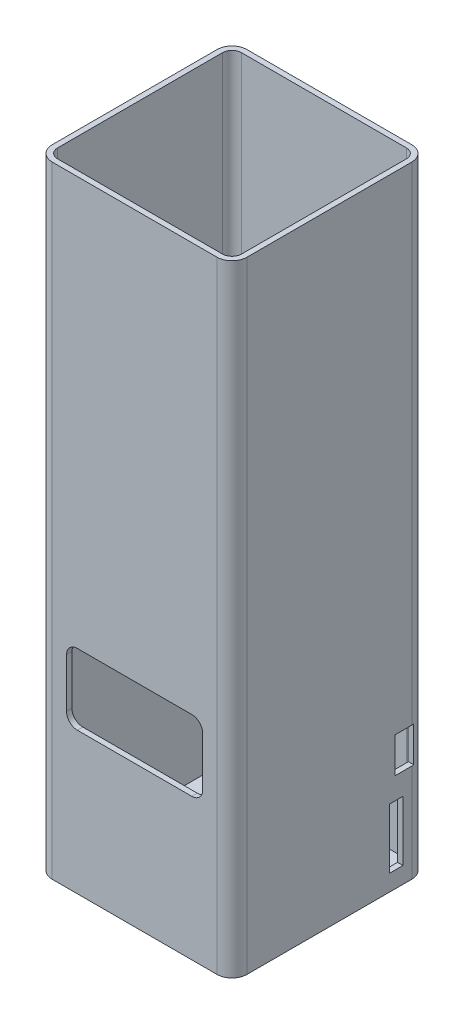
from build123d import *

# Parameters (mm, degrees)
AUFSATZ_LINEAR_AUSTRAGEN1_DEPTH = 113
AUFSATZ_LINEAR_START            = -1
SKIZZE1_4_R                     = 3
AUFSATZ_LINEAR_AUSTRAGEN2_DEPTH = 1
SCHNITT_LINEAR_AUSTRAGEN1_DEPTH = 1
SKIZZE3_W                       = 2.5
SKIZZE3_H                       = 11
SKIZZE3_W_2                     = 3.5
SKIZZE3_H_2                     = 6.5
SCHNITT_LINEAR_AUSTRAGEN2_DEPTH = 2


with BuildPart() as part:
    # Skizze1 → Aufsatz-Linear austragen1 (new body)
    with BuildSketch(Plane(origin=(0, 0, 0), x_dir=(1, 0, 0), z_dir=(0, 1, 0))):
        with BuildLine():
            Line((15.125, 17.875), (-15.125, 17.875))
            ThreePointArc((-15.125, 17.875), (-17.069543648, 17.069543648), (-17.875, 15.125))
            Line((-17.875, 15.125), (-17.875, -15.125))
            ThreePointArc((-17.875, -15.125), (-17.069543648, -17.069543648), (-15.125, -17.875))
            Line((-15.125, -17.875), (15.125, -17.875))
            ThreePointArc((15.125, -17.875), (17.069543648, -17.069543648), (17.875, -15.125))
            Line((17.875, -15.125), (17.875, 15.125))
            ThreePointArc((17.875, 15.125), (17.069543648, 17.069543648), (15.125, 17.875))
        make_face()
        with BuildLine():
            ThreePointArc((-16.875, 15.125), (-16.362436867, 16.362436867), (-15.125, 16.875))
            Line((-15.125, 16.875), (15.125, 16.875))
            ThreePointArc((15.125, 16.875), (16.362436867, 16.362436867), (16.875, 15.125))
            Line((16.875, 15.125), (16.875, 10))
            Line((16.875, 10), (16.875, -4))
            Line((16.875, -4), (16.875, -15.125))
            ThreePointArc((16.875, -15.125), (16.362436867, -16.362436867), (15.125, -16.875))
            Line((15.125, -16.875), (-15.125, -16.875))
            ThreePointArc((-15.125, -16.875), (-16.362436867, -16.362436867), (-16.875, -15.125))
            Line((-16.875, -15.125), (-16.875, -4))
            Line((-16.875, -4), (-16.875, 10))
            Line((-16.875, 10), (-16.875, 15.125))
        make_face(mode=Mode.SUBTRACT)
    extrude(amount=AUFSATZ_LINEAR_AUSTRAGEN1_DEPTH)

    # Skizze1<4> → Aufsatz-Linear austragen2 (add)
    with BuildSketch(Plane(origin=(0, 0, 0), x_dir=(1, 0, 0), z_dir=(0, 1, 0)).offset(AUFSATZ_LINEAR_START)):
        with BuildLine():
            Line((15.125, 17.875), (-15.125, 17.875))
            ThreePointArc((-15.125, 17.875), (-17.069543648, 17.069543648), (-17.875, 15.125))
            Line((-17.875, 15.125), (-17.875, -15.125))
            ThreePointArc((-17.875, -15.125), (-17.069543648, -17.069543648), (-15.125, -17.875))
            Line((-15.125, -17.875), (15.125, -17.875))
            ThreePointArc((15.125, -17.875), (17.069543648, -17.069543648), (17.875, -15.125))
            Line((17.875, -15.125), (17.875, 15.125))
            ThreePointArc((17.875, 15.125), (17.069543648, 17.069543648), (15.125, 17.875))
        make_face()
        with BuildLine():
            Line((12, 6), (12, 0))
            ThreePointArc((12, 0), (11.414213562, -1.414213562), (10, -2))
            Line((10, -2), (-10, -2))
            ThreePointArc((-10, -2), (-11.414213562, -1.414213562), (-12, 0))
            Line((-12, 0), (-12, 6))
            ThreePointArc((-12, 6), (-11.414213562, 7.414213562), (-10, 8))
            Line((-10, 8), (10, 8))
            ThreePointArc((10, 8), (11.414213562, 7.414213562), (12, 6))
        make_face(mode=Mode.SUBTRACT)
        with Locations((0, -9.5)):
            Circle(SKIZZE1_4_R, mode=Mode.SUBTRACT)
    extrude(amount=AUFSATZ_LINEAR_AUSTRAGEN2_DEPTH)

    # Skizze2 → Schnitt-Linear austragen1 (cut)
    with BuildSketch(Plane.XY.offset(17.875)):
        with BuildLine():
            Line((-10.5, 38), (10.5, 38))
            ThreePointArc((10.5, 38), (11.914213562, 37.414213562), (12.5, 36))
            Line((12.5, 36), (12.5, 27))
            ThreePointArc((12.5, 27), (11.914213562, 25.585786438), (10.5, 25))
            Line((10.5, 25), (-10.5, 25))
            ThreePointArc((-10.5, 25), (-11.914213562, 25.585786438), (-12.5, 27))
            Line((-12.5, 27), (-12.5, 36))
            ThreePointArc((-12.5, 36), (-11.914213562, 37.414213562), (-10.5, 38))
        make_face()
    extrude(amount=-SCHNITT_LINEAR_AUSTRAGEN1_DEPTH, mode=Mode.SUBTRACT)

    # Skizze3 → Schnitt-Linear austragen2 (cut)
    with BuildSketch(Plane(origin=(17.875, 0, 0), x_dir=(0, 0, -1), z_dir=(1, 0, 0))):
        with Locations((12.25, 7.5)):
            Rectangle(SKIZZE3_W, SKIZZE3_H)
        with Locations((13.75, 20.25)):
            Rectangle(SKIZZE3_W_2, SKIZZE3_H_2)
    extrude(amount=-SCHNITT_LINEAR_AUSTRAGEN2_DEPTH, mode=Mode.SUBTRACT)


solid = part.part
